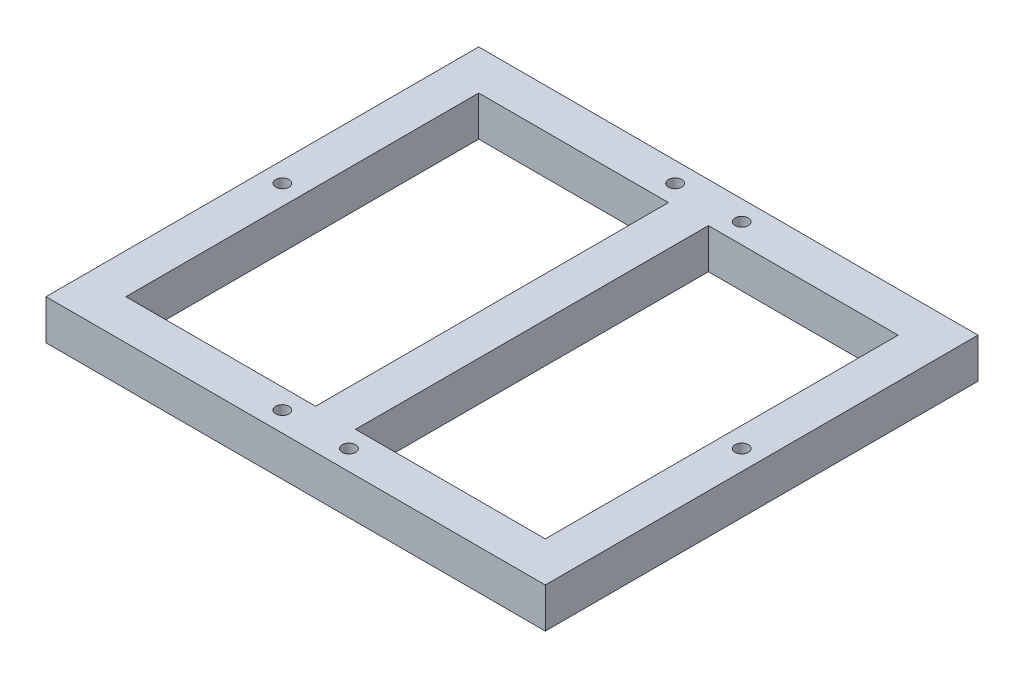
from build123d import *

# Parameters (mm, degrees)
SKETCH1_W           = 150
SKETCH1_H           = 130
SKETCH1_W_2         = 57
SKETCH1_H_2         = 106
BOSS_EXTRUDE1_DEPTH = 6
SKETCH2_R           = 2
CUT_EXTRUDE1_DEPTH  = 100.969995499


with BuildPart() as part:
    # Sketch1 → Boss-Extrude1 (new, symmetric)
    with BuildSketch(Plane(origin=(0, 0, 0), x_dir=(1, 0, 0), z_dir=(0, 1, 0))):
        Rectangle(SKETCH1_W, SKETCH1_H)
        with Locations((-34.5, 0)):
            Rectangle(SKETCH1_W_2, SKETCH1_H_2, mode=Mode.SUBTRACT)
        with Locations((34.5, 0)):
            Rectangle(SKETCH1_W_2, SKETCH1_H_2, mode=Mode.SUBTRACT)
    extrude(amount=BOSS_EXTRUDE1_DEPTH, both=True)

    # Sketch2 → Cut-Extrude1 (cut, through all)
    with BuildSketch(Plane(origin=(0, 6, 0), x_dir=(1, 0, 0), z_dir=(0, 1, 0))):
        with Locations(Location((-69, 0, 0), (0, 0, 270))):
            Circle(SKETCH2_R)
        with Locations(Location((69, 0, 0), (0, 0, 90))):
            Circle(SKETCH2_R)
        with Locations(Location((-10, -59, 0), (0, 0, 270))):
            Circle(SKETCH2_R)
        with Locations(Location((10, -59, 0), (0, 0, 90))):
            Circle(SKETCH2_R)
        with Locations(Location((-10, 59, 0), (0, 0, 90))):
            Circle(SKETCH2_R)
        with Locations(Location((10, 59, 0), (0, 0, 270))):
            Circle(SKETCH2_R)
    extrude(amount=-CUT_EXTRUDE1_DEPTH, mode=Mode.SUBTRACT)


solid = part.part
